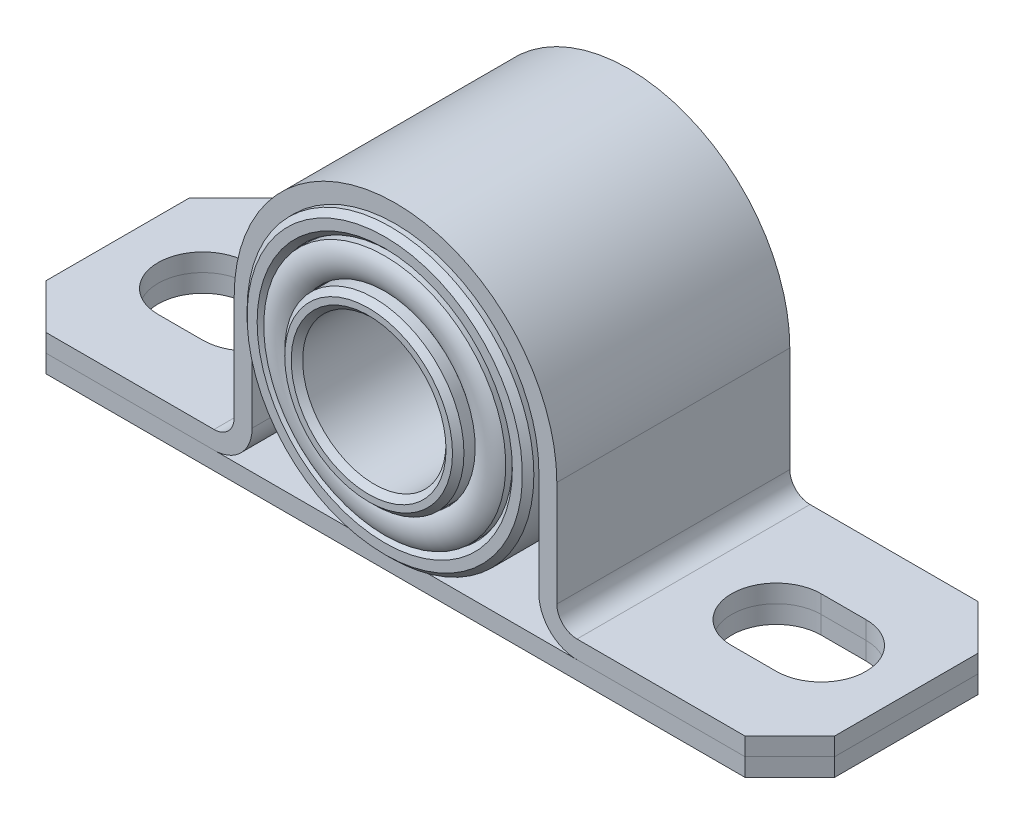
from build123d import *

# Parameters (mm, degrees)
SKETCH1_W                  = 69.85
SKETCH1_H                  = 20.6375
EXTRUDE1_DEPTH             = 1.5875
EXTRUDE2_REACH             = 38.452
EXTRUDE2_DIRECTION_2_REACH = 38.452
CUT_EXTRUDE1_DEPTH         = 47.289986515
CHAMFER3_SIZE              = 0.508
CHAMFER1_SIZE              = 3.96875
CHAMFER2_SIZE              = 3.96875


with BuildPart() as part:
    # Sketch1 → Extrude1 (new body)
    with BuildSketch(Plane(origin=(0, 0, 0), x_dir=(1, 0, 0), z_dir=(0, 1, 0))):
        Rectangle(SKETCH1_W, SKETCH1_H)
        with BuildLine():
            Line((-27.384375, -3.96875), (-23.415625, -3.96875))
            ThreePointArc((-23.415625, -3.96875), (-19.446875, 0), (-23.415625, 3.96875))
            Line((-23.415625, 3.96875), (-27.384375, 3.96875))
            ThreePointArc((-27.384375, 3.96875), (-31.353125, 0), (-27.384375, -3.96875))
        make_face(mode=Mode.SUBTRACT)
        with BuildLine():
            Line((23.415625, -3.96875), (27.384375, -3.96875))
            ThreePointArc((27.384375, -3.96875), (31.353125, 0), (27.384375, 3.96875))
            Line((27.384375, 3.96875), (23.415625, 3.96875))
            ThreePointArc((23.415625, 3.96875), (19.446875, 0), (23.415625, -3.96875))
        make_face(mode=Mode.SUBTRACT)
    extrude(amount=EXTRUDE1_DEPTH)


with BuildPart() as body_2:

    # Extrude2: up to this face of the body (flat: up to its plane)
    extrude2_end = Plane(part.part.faces().sort_by_distance((0, 0.79375, 10.31875))[0])
    # Sketch2 → Extrude2 (new, up to the picked face)
    with BuildSketch(Plane.XY, mode=Mode.PRIVATE) as extrude2_sk1:
        with BuildLine():
            Line((-34.925, 1.5875), (-16.0734375, 1.5875))
            ThreePointArc((-16.0734375, 1.5875), (-13.688056968, 2.575556968), (-12.7, 4.9609375))
            Line((-12.7, 4.9609375), (-12.7, 14.2875))
            ThreePointArc((-12.7, 14.2875), (0, 26.9875), (12.7, 14.2875))
            Line((12.7, 14.2875), (12.7, 4.9609375))
            ThreePointArc((12.7, 4.9609375), (13.688056968, 2.575556968), (16.0734375, 1.5875))
            Line((16.0734375, 1.5875), (34.925, 1.5875))
            Line((34.925, 1.5875), (34.925, 3.175))
            Line((34.925, 3.175), (16.0734375, 3.175))
            ThreePointArc((16.0734375, 3.175), (14.810588983, 3.698088983), (14.2875, 4.9609375))
            Line((14.2875, 4.9609375), (14.2875, 14.2875))
            ThreePointArc((14.2875, 14.2875), (0, 28.575), (-14.2875, 14.2875))
            Line((-14.2875, 14.2875), (-14.2875, 4.9609375))
            ThreePointArc((-14.2875, 4.9609375), (-14.810588983, 3.698088983), (-16.0734375, 3.175))
            Line((-16.0734375, 3.175), (-34.925, 3.175))
            Line((-34.925, 3.175), (-34.925, 1.5875))
        make_face()
    extrude2_tool1 = split(extrude(extrude2_sk1.sketch, amount=EXTRUDE2_REACH, mode=Mode.PRIVATE), bisect_by=extrude2_end, keep=Keep.BOTH, mode=Mode.PRIVATE)
    add(extrude2_tool1.solids().sort_by(Axis((-13.538678, 9.624219, 0), (0, 0, 1)))[0])


    # Extrude2 direction 2: up to this face of the body (flat: up to its plane)
    extrude2_direction_2_end = Plane(part.part.faces().sort_by_distance((0, 0.79375, -10.31875))[0])
    # Sketch2 → Extrude2 direction 2 (add, up to the picked face)
    with BuildSketch(Plane.XY, mode=Mode.PRIVATE) as extrude2_direction_2_sk1:
        with BuildLine():
            Line((-34.925, 1.5875), (-16.0734375, 1.5875))
            ThreePointArc((-16.0734375, 1.5875), (-13.688056968, 2.575556968), (-12.7, 4.9609375))
            Line((-12.7, 4.9609375), (-12.7, 14.2875))
            ThreePointArc((-12.7, 14.2875), (0, 26.9875), (12.7, 14.2875))
            Line((12.7, 14.2875), (12.7, 4.9609375))
            ThreePointArc((12.7, 4.9609375), (13.688056968, 2.575556968), (16.0734375, 1.5875))
            Line((16.0734375, 1.5875), (34.925, 1.5875))
            Line((34.925, 1.5875), (34.925, 3.175))
            Line((34.925, 3.175), (16.0734375, 3.175))
            ThreePointArc((16.0734375, 3.175), (14.810588983, 3.698088983), (14.2875, 4.9609375))
            Line((14.2875, 4.9609375), (14.2875, 14.2875))
            ThreePointArc((14.2875, 14.2875), (0, 28.575), (-14.2875, 14.2875))
            Line((-14.2875, 14.2875), (-14.2875, 4.9609375))
            ThreePointArc((-14.2875, 4.9609375), (-14.810588983, 3.698088983), (-16.0734375, 3.175))
            Line((-16.0734375, 3.175), (-34.925, 3.175))
            Line((-34.925, 3.175), (-34.925, 1.5875))
        make_face()
    extrude2_direction_2_tool1 = split(extrude(extrude2_direction_2_sk1.sketch, amount=-EXTRUDE2_DIRECTION_2_REACH, mode=Mode.PRIVATE), bisect_by=extrude2_direction_2_end, keep=Keep.BOTH, mode=Mode.PRIVATE)
    add(extrude2_direction_2_tool1.solids().sort_by(Axis((-13.538678, 9.624219, 0), (0, 0, -1)))[0])

    # Sketch3 → Cut-Extrude1 (cut, through all)
    with BuildSketch(Plane(origin=(0, 0, 0), x_dir=(1, 0, 0), z_dir=(0, 1, 0))):
        with BuildLine():
            Line((23.415625, -3.96875), (27.384375, -3.96875))
            ThreePointArc((27.384375, -3.96875), (31.353125, 0), (27.384375, 3.96875))
            Line((27.384375, 3.96875), (23.415625, 3.96875))
            ThreePointArc((23.415625, 3.96875), (19.446875, 0), (23.415625, -3.96875))
        make_face()
        with BuildLine():
            Line((-27.384375, -3.96875), (-23.415625, -3.96875))
            ThreePointArc((-23.415625, -3.96875), (-19.446875, 0), (-23.415625, 3.96875))
            Line((-23.415625, 3.96875), (-27.384375, 3.96875))
            ThreePointArc((-27.384375, 3.96875), (-31.353125, 0), (-27.384375, -3.96875))
        make_face()
    extrude(amount=CUT_EXTRUDE1_DEPTH, mode=Mode.SUBTRACT)

    # Chamfer2
    chamfer2_edges = [body_2.edges().sort_by_distance(p)[0] for p in [
        (34.925, 2.38125, 10.31875),
        (-34.925, 2.38125, 10.31875),
        (-34.925, 2.38125, -10.31875),
        (34.925, 2.38125, -10.31875),
    ]]
    chamfer(chamfer2_edges, length=CHAMFER2_SIZE)


with BuildPart() as body_3:
    # Sketch4 → Revolve1 (revolve)
    with BuildSketch(Plane(origin=(0, 0, 0), x_dir=(0, 0, -1), z_dir=(1, 0, 0))):
        with BuildLine():
            Line((0, 26.9875), (-11.27125, 26.9875))
            Line((-11.27125, 26.9875), (-11.27125, 25.0825))
            Line((-11.27125, 25.0825), (-10.50925, 25.0825))
            Line((-10.50925, 25.0825), (-10.50925, 25.0063))
            Line((-10.50925, 25.0063), (-11.27125, 25.0063))
            ThreePointArc((-11.27125, 25.0063), (-11.7475, 23.65375), (-11.27125, 22.3012))
            Line((-11.27125, 22.3012), (-10.50925, 22.3012))
            Line((-10.50925, 22.3012), (-10.50925, 22.225))
            Line((-10.50925, 22.225), (-11.27125, 22.225))
            Line((-11.27125, 22.225), (-12.7, 22.225))
            Line((-12.7, 22.225), (-12.7, 20.6375))
            Line((-12.7, 20.6375), (0, 20.6375))
            Line((0, 20.6375), (0, 26.9875))
        make_face()
    revolve(axis=Axis((0, 14.2875, 0), (0, 0, 1)))

    # Chamfer3
    chamfer3_edges = [body_3.edges().sort_by_distance(p)[0] for p in [
        (0, 3.4925, 11.27125),
        (0, 1.5875, 11.27125),
        (0, 7.9375, 12.7),
        (0, 6.35, 12.7),
    ]]
    chamfer(chamfer3_edges, length=CHAMFER3_SIZE)

    # Mirror2: body 3 across plane


with BuildPart() as body_3_1:
    add(body_3.part)
    add(body_3.part.mirror(Plane.XY))


with BuildPart() as part_1:
    add(part.part)

    # Chamfer1
    chamfer1_edges = [part_1.edges().sort_by_distance(p)[0] for p in [
        (-34.925, 0.79375, -10.31875),
        (34.925, 0.79375, -10.31875),
        (34.925, 0.79375, 10.31875),
        (-34.925, 0.79375, 10.31875),
    ]]
    chamfer(chamfer1_edges, length=CHAMFER1_SIZE)


solid = Compound([body_2.part, body_3_1.part, part_1.part])
